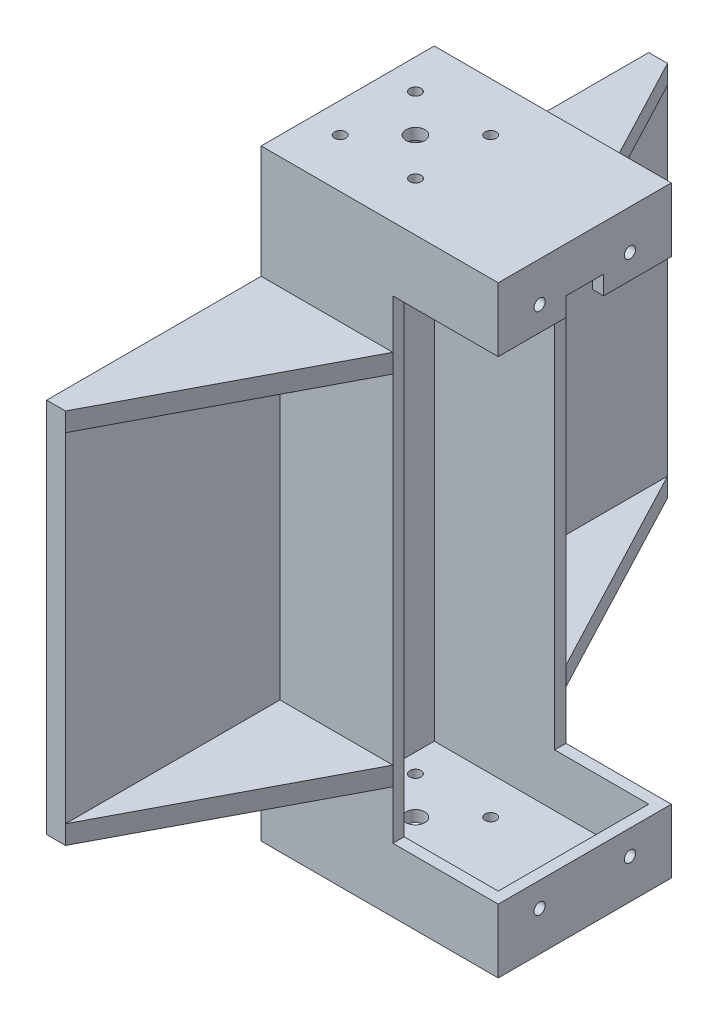
from build123d import *

# Parameters (mm, degrees)
SKETCH1_W       = 60
SKETCH1_H       = 40
EXTRUDE1_DEPTH  = 3
SKETCH2_W       = 3
SKETCH2_H       = 40
EXTRUDE2_DEPTH  = 14
SKETCH4_R       = 1.5
EXTRUDE3_DEPTH  = 15
SKETCH5_W       = 57
SKETCH5_H       = 14
EXTRUDE4_DEPTH  = 3
SKETCH6_W       = 57
SKETCH6_H       = 14
EXTRUDE5_DEPTH  = 3
SKETCH7_R       = 1.5
EXTRUDE6_DEPTH  = 3
SKETCH8_R       = 2.5
EXTRUDE7_DEPTH  = 3
SKETCH9_W       = 40
SKETCH9_H       = 17
EXTRUDE8_DEPTH  = 3
EXTRUDE9_DEPTH  = 63
EXTRUDE10_DEPTH = 3
EXTRUDE11_DEPTH = 3
EXTRUDE12_DEPTH = 3
EXTRUDE13_DEPTH = 3
SKETCH15_W      = 160
SKETCH15_H      = 100
EXTRUDE14_DEPTH = 5
EXTRUDE15_DEPTH = 5
EXTRUDE16_DEPTH = 5
SKETCH18_W      = 40
SKETCH18_H      = 100
EXTRUDE17_DEPTH = 2
SKETCH19_W      = 10
SKETCH19_H      = 10
EXTRUDE18_DEPTH = 5


with BuildPart() as part:
    # Sketch1 → Extrude1 (new body)
    with BuildSketch(Plane(origin=(0, 0, 0), x_dir=(1, 0, 0), z_dir=(0, 1, 0))):
        Rectangle(SKETCH1_W, SKETCH1_H)
    extrude(amount=EXTRUDE1_DEPTH)

    # Sketch2 → Extrude2 (add)
    with BuildSketch(Plane(origin=(0, 3, 0), x_dir=(1, 0, 0), z_dir=(0, 1, 0))):
        with Locations((28.5, 0)):
            Rectangle(SKETCH2_W, SKETCH2_H)
    extrude(amount=EXTRUDE2_DEPTH)

    # Sketch4 → Extrude3 (cut)
    with BuildSketch(Plane.ZY.offset(-27)):
        with Locations((-12, 10.5)):
            Circle(SKETCH4_R)
        with Locations((12, 10.5)):
            Circle(SKETCH4_R)
    extrude(amount=-EXTRUDE3_DEPTH, mode=Mode.SUBTRACT)

    # Sketch5 → Extrude4 (add)
    with BuildSketch(Plane(origin=(0, 0, -20), x_dir=(-1, 0, 0), z_dir=(0, 0, -1))):
        with Locations((1.5, 10)):
            Rectangle(SKETCH5_W, SKETCH5_H)
    extrude(amount=-EXTRUDE4_DEPTH)

    # Sketch6 → Extrude5 (add)
    with BuildSketch(Plane.XY.offset(20)):
        with Locations((-1.5, 10)):
            Rectangle(SKETCH6_W, SKETCH6_H)
    extrude(amount=-EXTRUDE5_DEPTH)

    # Sketch7 → Extrude6 (cut)
    with BuildSketch(Plane(origin=(0, 3, 0), x_dir=(1, 0, 0), z_dir=(0, 1, 0))):
        with Locations(Location((-5, 10, 0), (0, 0, 270))):
            Circle(SKETCH7_R)
        with Locations(Location((-25, 10, 0), (0, 0, 270))):
            Circle(SKETCH7_R)
        with Locations(Location((-25, -10, 0), (0, 0, 270))):
            Circle(SKETCH7_R)
        with Locations(Location((-5, -10, 0), (0, 0, 270))):
            Circle(SKETCH7_R)
    extrude(amount=-EXTRUDE6_DEPTH, mode=Mode.SUBTRACT)

    # Sketch8 → Extrude7 (cut)
    with BuildSketch(Plane(origin=(0, 3, 0), x_dir=(1, 0, 0), z_dir=(0, 1, 0))):
        with Locations(Location((-15, 0, 0), (0, 0, 270))):
            Circle(SKETCH8_R)
    extrude(amount=-EXTRUDE7_DEPTH, mode=Mode.SUBTRACT)

    # Sketch9 → Extrude8 (add)
    with BuildSketch(Plane.ZY.offset(30)):
        with Locations((0, 8.5)):
            Rectangle(SKETCH9_W, SKETCH9_H)
    extrude(amount=EXTRUDE8_DEPTH)

    # Sketch10 → Extrude9 (add)
    with BuildSketch(Plane(origin=(0, 17, 0), x_dir=(1, 0, 0), z_dir=(0, 1, 0))):
        Polygon((-30, -17), (-30, 17), (2, 17), (2, 20), (-33, 20), (-33, -20), (2, -20), (2, -17), align=None)
    extrude(amount=EXTRUDE9_DEPTH)

    # Mirror2: part across plane


with BuildPart() as part_1:
    add(part.part)
    add(part.part.mirror(Plane.ZX.offset(80)))

    # Sketch11 → Extrude10 (add)
    with BuildSketch(Plane.XY.offset(20)):
        Polygon((-33, 0), (30, 0), (30, 17), (2, 17), (2, 143), (30, 143), (30, 160), (-33, 160), align=None)
    extrude(amount=EXTRUDE10_DEPTH)

    # Sketch12 → Extrude11 (add)
    with BuildSketch(Plane(origin=(0, 0, -20), x_dir=(-1, 0, 0), z_dir=(0, 0, -1))):
        Polygon((-30, 0), (33, 0), (33, 160), (-30, 160), (-30, 143), (-2, 143), (-2, 17), (-30, 17), align=None)
    extrude(amount=EXTRUDE11_DEPTH)

    # Sketch13 → Extrude12 (cut)
    with BuildSketch(Plane(origin=(0, 0, 17), x_dir=(-1, 0, 0), z_dir=(0, 0, -1))):
        Polygon((-27, 17), (-27, 3), (30, 3), (30, 157), (-27, 157), (-27, 143), (-2, 143), (-2, 17), align=None)
    extrude(amount=-EXTRUDE12_DEPTH, mode=Mode.SUBTRACT)

    # Sketch14 → Extrude13 (cut)
    with BuildSketch(Plane.XY.offset(-17)):
        Polygon((27, 17), (2, 17), (2, 143), (27, 143), (27, 157), (-30, 157), (-30, 3), (27, 3), align=None)
    extrude(amount=-EXTRUDE13_DEPTH, mode=Mode.SUBTRACT)

    # Sketch15 → Extrude14 (add)
    with BuildSketch(Plane.ZY.offset(33)):
        with Locations((0, 80)):
            Rectangle(SKETCH15_W, SKETCH15_H)
    extrude(amount=-EXTRUDE14_DEPTH)

    # Sketch16 → Extrude15 (add)
    with BuildSketch(Plane.XZ.offset(-30)):
        Polygon((-28, -23), (2, -23), (-28, -80), align=None)
        Polygon((-28, 23), (2, 23), (-28, 80), align=None)
    extrude(amount=-EXTRUDE15_DEPTH)

    # Sketch17 → Extrude16 (add)
    with BuildSketch(Plane(origin=(0, 130, 0), x_dir=(1, 0, 0), z_dir=(0, 1, 0))):
        Polygon((-28, 80), (-28, 23), (2, 23), align=None)
        Polygon((-28, -23), (-28, -80), (2, -23), align=None)
    extrude(amount=-EXTRUDE16_DEPTH)

    # Sketch18 → Extrude17 (cut)
    with BuildSketch(Plane(origin=(-28, 0, 0), x_dir=(0, 0, -1), z_dir=(1, 0, 0))):
        with Locations((0, 80)):
            Rectangle(SKETCH18_W, SKETCH18_H)
    extrude(amount=-EXTRUDE17_DEPTH, mode=Mode.SUBTRACT)

    # Sketch19 → Extrude18 (cut)
    with BuildSketch(Plane(origin=(30, 0, 0), x_dir=(0, 0, -1), z_dir=(1, 0, 0))):
        with Locations((0, 143)):
            Rectangle(SKETCH19_W, SKETCH19_H)
    extrude(amount=-EXTRUDE18_DEPTH, mode=Mode.SUBTRACT)


solid = part_1.part
